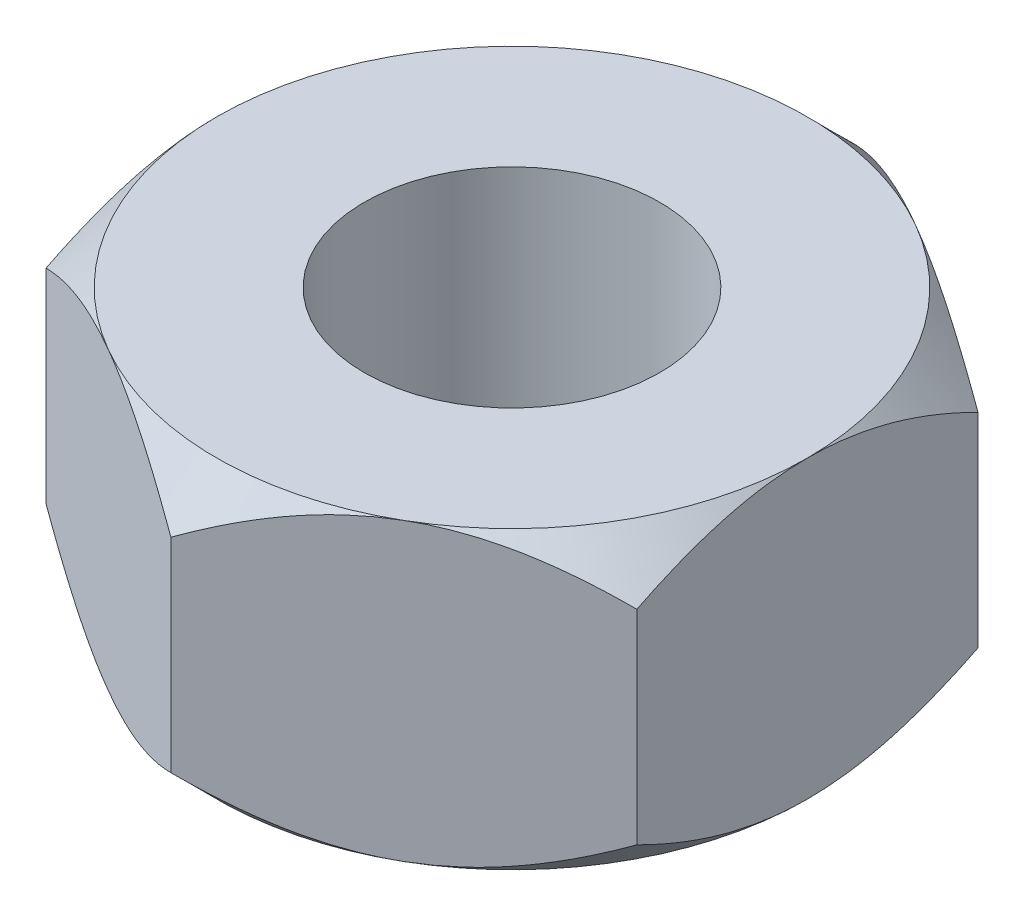
from build123d import *

# Parameters (mm, degrees)
SKETCH1_R           = 2
BOSS_EXTRUDE1_DEPTH = 2


with BuildPart() as part:
    # Sketch1 → Boss-Extrude1 (new, symmetric)
    with BuildSketch(Plane(origin=(0, 0, 0), x_dir=(1, 0, 0), z_dir=(0, 1, 0))):
        Polygon((0, 4.618802154), (-4, 2.309401077), (-4, -2.309401077), (0, -4.618802154), (4, -2.309401077), (4, 2.309401077), align=None)
        with Locations(Location((0, 0, 0), (0, 0, 270))):
            Circle(SKETCH1_R, mode=Mode.SUBTRACT)
    extrude(amount=BOSS_EXTRUDE1_DEPTH, both=True)

    # Cut-Sweep1: sweep along a path in Sketch2
    with BuildLine(Plane(origin=(0, 2, 0), x_dir=(1, 0, 0), z_dir=(0, 1, 0))) as cut_sweep1_path:
        CenterArc((0, 0), 4, 0, 360)
    # Sketch3 → Cut-Sweep1 (sweep, cut)
    with BuildSketch(Plane.XY):
        Polygon((-4.65, 1.35), (-4, 2), (-4.65, 2), align=None)
    cut_sweep1 = sweep(path=cut_sweep1_path.line, mode=Mode.SUBTRACT)

    # Mirror1: Cut-Sweep1 across plane
    add(cut_sweep1.mirror(Plane.ZX), mode=Mode.SUBTRACT)


solid = part.part
